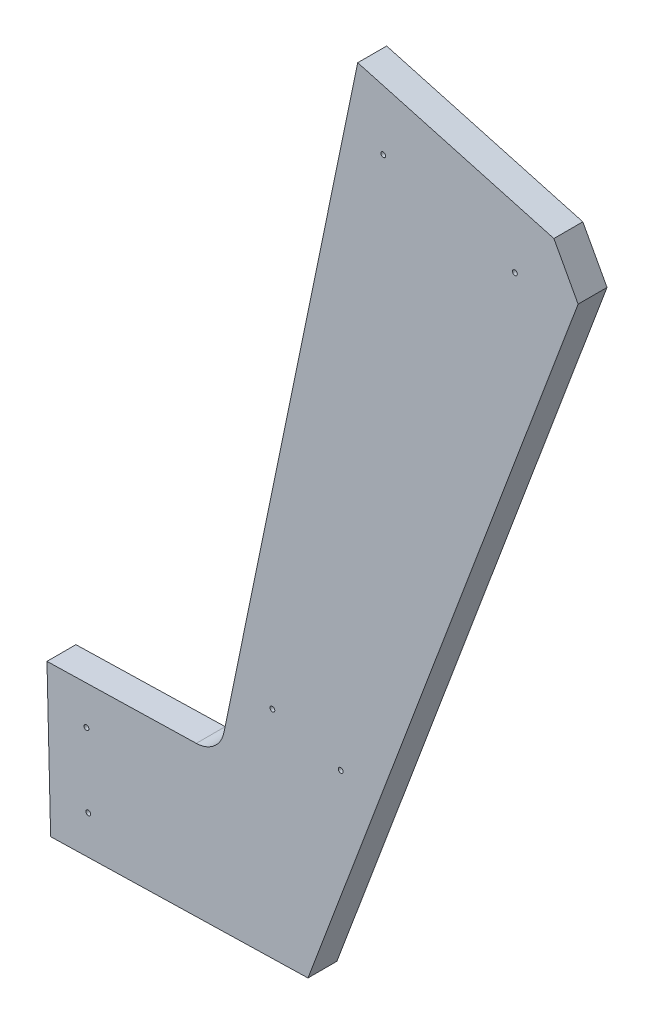
from build123d import *

# Parameters (mm, degrees)
BOSS_EXTRUDE1_DEPTH = 19.05
HOLE3_D             = 3.175
HOLE3_DEPTH         = 38.1
HOLE3_CSINK_D       = 10.16
HOLE3_CSINK_ANGLE   = 82
HOLE3_TIP           = 0.953866233


with BuildPart() as part:
    # Sketch1 → Boss-Extrude1 (new body)
    with BuildSketch(Plane.XY):
        with BuildLine():
            Line((-61.753066592, -505.133747826), (-59.340316311, -603.947946941))
            Line((-59.340316311, -603.947946941), (110.157739028, -599.809306096))
            Line((110.157739028, -599.809306096), (288.094390135, -126.448741632))
            Line((288.094390135, -126.448741632), (272.141590142, -96.993017293))
            Line((272.141590142, -96.993017293), (142.933900932, -61.306223753))
            Line((142.933900932, -61.306223753), (54.780700044, -487.546357698))
            ThreePointArc((54.780700044, -487.546357698), (48.334106484, -498.311851218), (36.590496304, -502.732489089))
            Line((36.590496304, -502.732489089), (-61.753066592, -505.133747826))
        make_face()
    extrude(amount=BOSS_EXTRUDE1_DEPTH)

    # Hole3
    with Locations(Plane(origin=(295.820901284, -105.894091108, -19.05), x_dir=(-0.3518626346959965, -0.9360516472421764, 8.51430303154421e-15), z_dir=(0, 0, -1))):
        with Locations((47.413288654, 127.596711745), (39.315467427, 37.945520226), (403.288916316, 71.764018496), (399.091743996, 25.297013484), (513.561319184, 161.164706775), (558.106616554, 143.167238399), (571.189751829, 175.54913452), (654.969392627, 382.911022042), (526.644454459, 193.546602895), (610.424095257, 400.908490418)):
            CounterSinkHole(HOLE3_D / 2, HOLE3_CSINK_D / 2, depth=HOLE3_DEPTH, counter_sink_angle=HOLE3_CSINK_ANGLE)
            with Locations((0, 0, -(HOLE3_DEPTH + HOLE3_TIP / 2))):  # 118° drill point
                Cone(0, HOLE3_D / 2, HOLE3_TIP, mode=Mode.SUBTRACT)


solid = part.part
